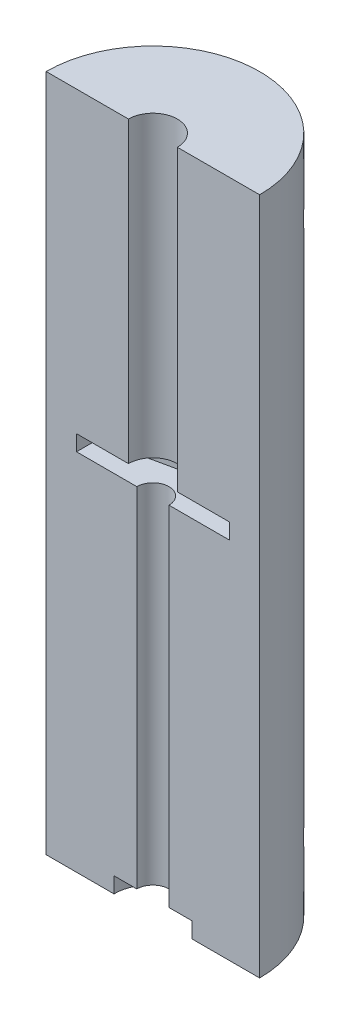
from build123d import *

# Parameters (mm, degrees)
BOSS_EXTRUDE1_DEPTH = 95
CUT_EXTRUDE1_DEPTH  = 2.2
CUT_EXTRUDE2_DEPTH  = 48.8
CUT_EXTRUDE3_DEPTH  = 2.2
SKETCH8_R           = 3.425
CUT_EXTRUDE4_DEPTH  = 50
FILLET1_R           = 1
SKETCH11_R          = 3
CUT_EXTRUDE5_DEPTH  = 15


with BuildPart() as part:
    # Sketch1 → Boss-Extrude1 (new body)
    with BuildSketch(Plane(origin=(0, 0, 0), x_dir=(1, 0, 0), z_dir=(0, 1, 0))):
        with BuildLine():
            ThreePointArc((0, 0), (14.95, 14.95), (29.9, 0))
            Line((29.9, 0), (0, 0))
        make_face()
    extrude(amount=BOSS_EXTRUDE1_DEPTH)

    # Sketch4 → Cut-Extrude1 (cut)
    with BuildSketch(Plane(origin=(0, 0, 0), x_dir=(1, 0, 0), z_dir=(0, 1, 0))):
        with BuildLine():
            Line((20.4, 0), (9.5, 0))
            ThreePointArc((9.5, 0), (14.95, 5.45), (20.4, 0))
        make_face()
    extrude(amount=CUT_EXTRUDE1_DEPTH, mode=Mode.SUBTRACT)

    # Sketch5 → Cut-Extrude2 (cut)
    with BuildSketch(Plane(origin=(0, 2.2, 0), x_dir=(-1, 0, 0), z_dir=(0, -1, 0))):
        with BuildLine():
            ThreePointArc((-12.7, 0), (-14.95, 2.25), (-17.2, 0))
            Line((-17.2, 0), (-12.7, 0))
        make_face()
        with BuildLine():
            Line((-12.7, 0), (-17.2, 0))
            ThreePointArc((-17.2, 0), (-14.95, -2.25), (-12.7, 0))
        make_face()
    extrude(amount=-CUT_EXTRUDE2_DEPTH, mode=Mode.SUBTRACT)

    # Sketch6 → Cut-Extrude3 (cut)
    with BuildSketch(Plane(origin=(0, 51, 0), x_dir=(1, 0, 0), z_dir=(0, 1, 0))):
        Polygon((25.65, 0), (4.25, 0), (4.25, 3), (14.95, 5.3), (25.65, 3), align=None)
    extrude(amount=CUT_EXTRUDE3_DEPTH, mode=Mode.SUBTRACT)

    # Sketch8 → Cut-Extrude4 (cut)
    with BuildSketch(Plane(origin=(0, 53.2, 0), x_dir=(-1, 0, 0), z_dir=(0, -1, 0))):
        with Locations((-14.95, 0)):
            Circle(SKETCH8_R)
    extrude(amount=-CUT_EXTRUDE4_DEPTH, mode=Mode.SUBTRACT)

    # Fillet1
    fillet1_edges = [part.edges().sort_by_distance(p)[0] for p in [
        (4.25, 52.1, -3),
        (25.65, 52.1, -3),
        (14.95, 52.1, -5.3),
    ]]
    fillet(fillet1_edges, radius=FILLET1_R)

    # Sketch11 → Cut-Extrude5 (cut)
    with BuildSketch(Plane.XY.offset(-0.8)):
        with Locations((5.375, 85)):
            Circle(SKETCH11_R)
        with Locations((23.125, 85)):
            Circle(SKETCH11_R)
        with Locations((5.375, 10)):
            Circle(SKETCH11_R)
        with Locations((23.125, 10)):
            Circle(SKETCH11_R)
    extrude(amount=-CUT_EXTRUDE5_DEPTH, mode=Mode.SUBTRACT)


solid = part.part
